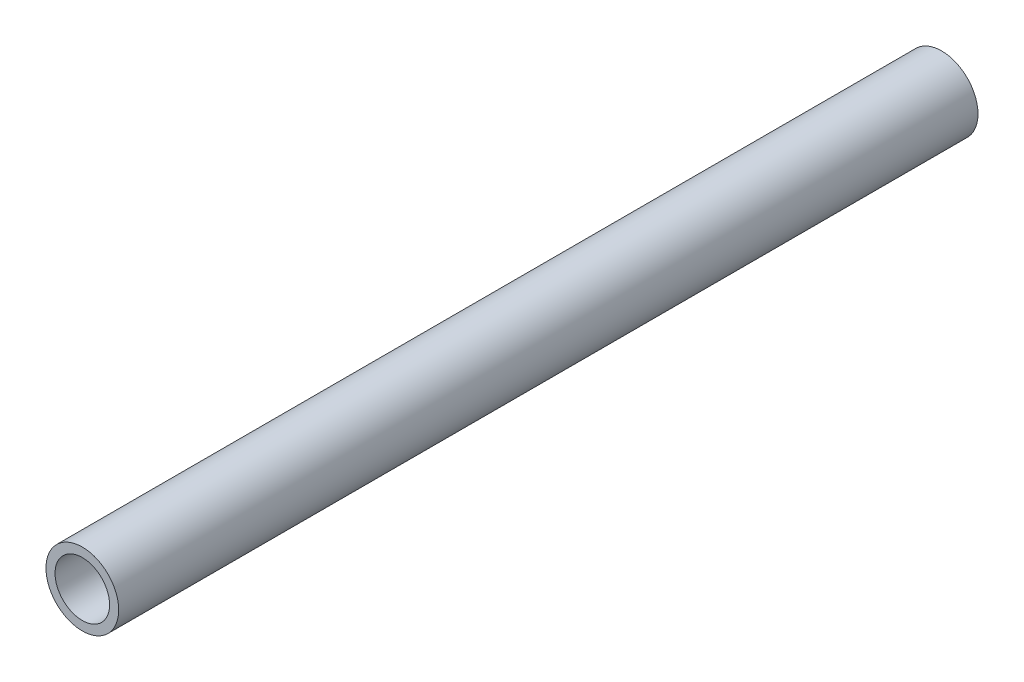
from build123d import *

# Parameters (mm, degrees)
SKETCH1_R           = 6.35
SKETCH1_R_2         = 4.7625
BOSS_EXTRUDE1_DEPTH = 150


with BuildPart() as part:
    # Sketch1 → Boss-Extrude1 (new body)
    with BuildSketch(Plane.XY):
        Circle(SKETCH1_R)
        Circle(SKETCH1_R_2, mode=Mode.SUBTRACT)
    extrude(amount=BOSS_EXTRUDE1_DEPTH)


solid = part.part
